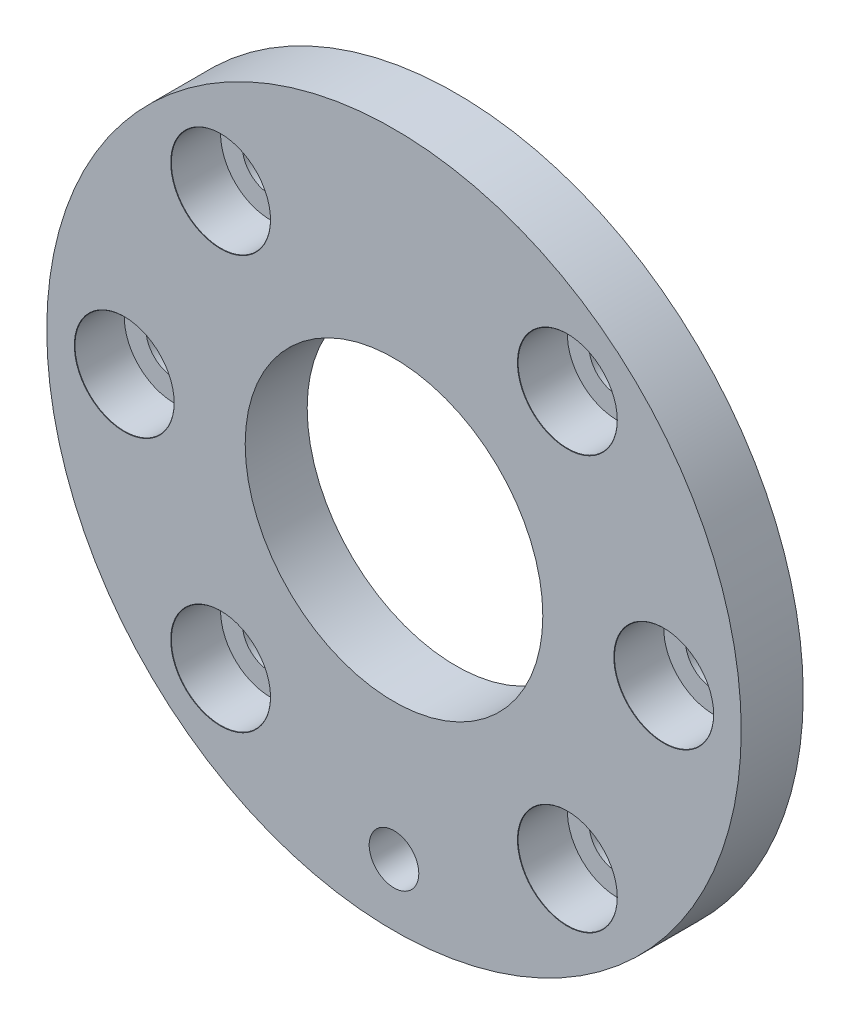
from build123d import *

# Parameters (mm, degrees)
SKETCH_1_R                  = 28
SKETCH_1_R_2                = 12
EXTRUDE_1_DEPTH             = 5
HOLE_WIZARD_M4_1_AT_2_COUNT = 2
HOLE_WIZARD_M4_1_AT_2_PITCH = 39.424388736
HOLE_WIZARD_M4_1_AT_3_COUNT = 2
HOLE_WIZARD_M4_1_AT_3_PITCH = 39.424388736
HOLE_WIZARD_M4_1_AT_4_COUNT = 2
HOLE_WIZARD_M4_1_AT_4_PITCH = 18.383894388
HOLE_WIZARD_M4_1_AT_5_COUNT = 2
HOLE_WIZARD_M4_1_AT_5_PITCH = 39.424388736
HOLE_WIZARD_M4_1_AT_6_COUNT = 2
HOLE_WIZARD_M4_1_AT_6_PITCH = 18.383894388
HOLE_WIZARD_M4_1_AT_7_COUNT = 2
HOLE_WIZARD_M4_1_AT_7_PITCH = 43.5
SKETCH_4_R                  = 2
CUT_EXTRUDE_1_DEPTH         = 10


with BuildPart() as part:
    # 草图1 → 凸台-拉伸1 (new body)
    with BuildSketch(Plane.XY):
        Circle(SKETCH_1_R)
        Circle(SKETCH_1_R_2, mode=Mode.SUBTRACT)
    extrude(amount=EXTRUDE_1_DEPTH)

    # 草图3 → M4 六角凹头盖的柱孔1 (revolve, cut)
    with BuildSketch(Plane(origin=(21.75, 0, 5), x_dir=(0, -1, 0), z_dir=(1, 0, 0))):
        Polygon((0, 0), (0, 5), (2.25, 5), (2.25, 4), (4, 4), (4, 0.024142219), (4.025, 0), align=None)
    hole_wizard_m4_1 = revolve(axis=Axis((21.75, 0, 11.35), (0, 0, -1)), mode=Mode.SUBTRACT)

    # M4 六角凹头盖的柱孔1 at 2: M4 六角凹头盖的柱孔1 ×2
    with Locations(*[Vector(-0.9063077870366496, 0.42261826174070033, 0) * (i * HOLE_WIZARD_M4_1_AT_2_PITCH) for i in range(1, HOLE_WIZARD_M4_1_AT_2_COUNT)]):
        add(hole_wizard_m4_1, mode=Mode.SUBTRACT)

    # M4 六角凹头盖的柱孔1 at 3: M4 六角凹头盖的柱孔1 ×2
    with Locations(*[Vector(-0.9063077870125524, 0.42261826179237694, 0) * (i * HOLE_WIZARD_M4_1_AT_3_PITCH) for i in range(1, HOLE_WIZARD_M4_1_AT_3_COUNT)]):
        add(hole_wizard_m4_1, mode=Mode.SUBTRACT)

    # M4 六角凹头盖的柱孔1 at 4: M4 六角凹头盖的柱孔1 ×2
    with Locations(*[Vector(-0.42261826172613226, -0.9063077870434427, 0) * (i * HOLE_WIZARD_M4_1_AT_4_PITCH) for i in range(1, HOLE_WIZARD_M4_1_AT_4_COUNT)]):
        add(hole_wizard_m4_1, mode=Mode.SUBTRACT)

    # M4 六角凹头盖的柱孔1 at 5: M4 六角凹头盖的柱孔1 ×2
    with Locations(*[Vector(-0.9063077870125524, -0.42261826179237694, 0) * (i * HOLE_WIZARD_M4_1_AT_5_PITCH) for i in range(1, HOLE_WIZARD_M4_1_AT_5_COUNT)]):
        add(hole_wizard_m4_1, mode=Mode.SUBTRACT)

    # M4 六角凹头盖的柱孔1 at 6: M4 六角凹头盖的柱孔1 ×2
    with Locations(*[Vector(-0.42261826172613226, 0.9063077870434427, 0) * (i * HOLE_WIZARD_M4_1_AT_6_PITCH) for i in range(1, HOLE_WIZARD_M4_1_AT_6_COUNT)]):
        add(hole_wizard_m4_1, mode=Mode.SUBTRACT)

    # M4 六角凹头盖的柱孔1 at 7: M4 六角凹头盖的柱孔1 ×2
    with Locations(*[(-i * HOLE_WIZARD_M4_1_AT_7_PITCH, 0, 0) for i in range(1, HOLE_WIZARD_M4_1_AT_7_COUNT)]):
        add(hole_wizard_m4_1, mode=Mode.SUBTRACT)

    # 草图4 → 切除-拉伸1 (cut)
    with BuildSketch(Plane.XY):
        with Locations((0, -23)):
            Circle(SKETCH_4_R)
    extrude(amount=CUT_EXTRUDE_1_DEPTH, mode=Mode.SUBTRACT)


solid = part.part
